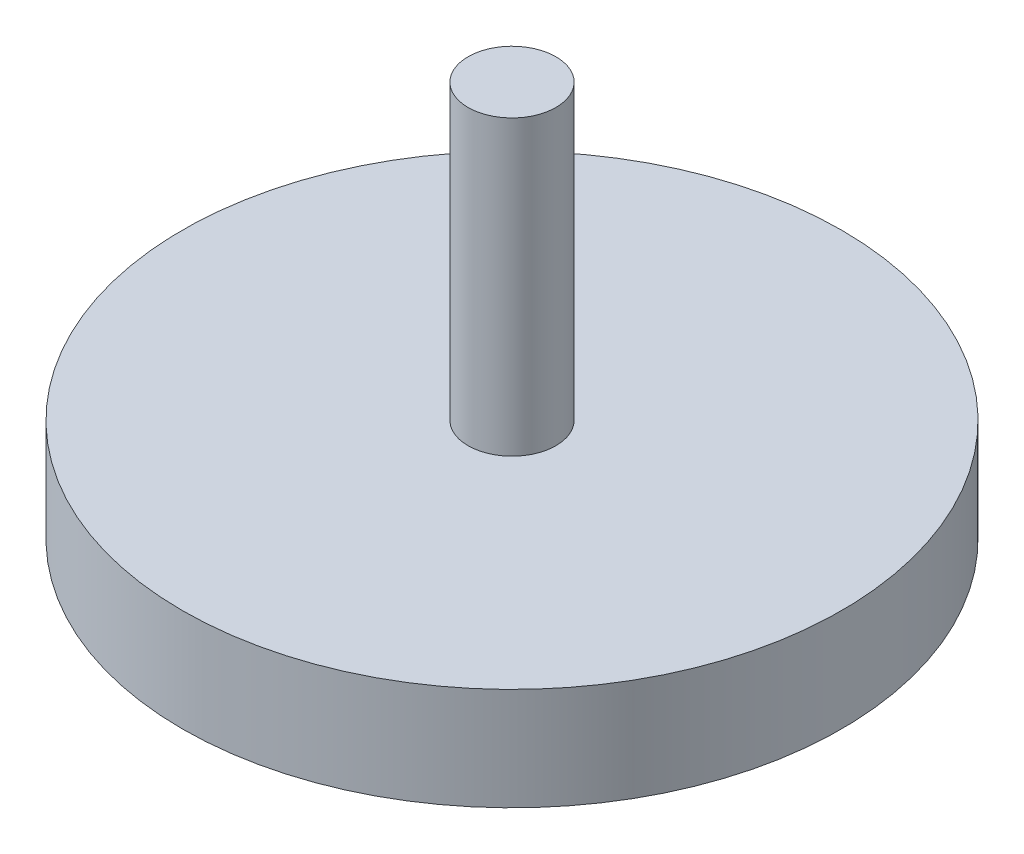
from build123d import *

# Parameters (mm, degrees)
SKETCH1_R           = 22.5
BOSS_EXTRUDE1_DEPTH = 7
SKETCH2_R           = 3
BOSS_EXTRUDE2_DEPTH = 20
CUT_EXTRUDE1_DEPTH  = 5


with BuildPart() as part:
    # Sketch1 → Boss-Extrude1 (new body)
    with BuildSketch(Plane(origin=(0, 0, 0), x_dir=(1, 0, 0), z_dir=(0, 1, 0))):
        with Locations(Location((0, 0, 0), (0, 0, 270))):
            Circle(SKETCH1_R)
    extrude(amount=BOSS_EXTRUDE1_DEPTH)

    # Sketch2 → Boss-Extrude2 (add)
    with BuildSketch(Plane(origin=(0, 7, 0), x_dir=(1, 0, 0), z_dir=(0, 1, 0))):
        with Locations(Location((0, 0, 0), (0, 0, 270))):
            Circle(SKETCH2_R)
    extrude(amount=BOSS_EXTRUDE2_DEPTH)

    # Sketch3 → Cut-Extrude1 (cut)
    with BuildSketch(Plane.XZ):
        Polygon((4.763139721, -2.75), (4.763139721, 2.75), (0, 5.5), (-4.763139721, 2.75), (-4.763139721, -2.75), (0, -5.5), align=None)
    extrude(amount=-CUT_EXTRUDE1_DEPTH, mode=Mode.SUBTRACT)


solid = part.part
